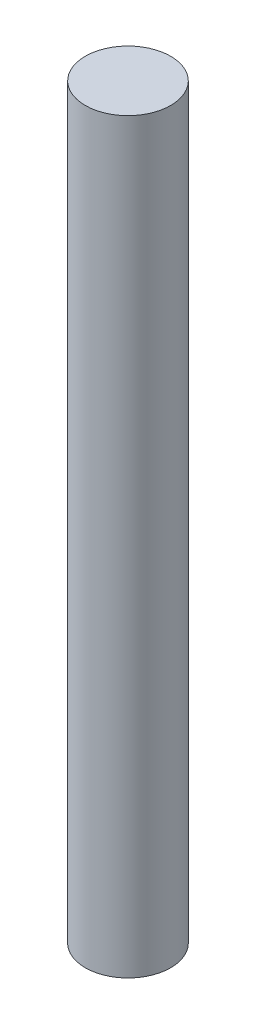
from build123d import *

# Parameters (mm, degrees)
SKETCH1_R           = 1
BOSS_EXTRUDE1_DEPTH = 17.5


with BuildPart() as part:
    # Sketch1 → Boss-Extrude1 (new body)
    with BuildSketch(Plane(origin=(0, 0, 0), x_dir=(1, 0, 0), z_dir=(0, 1, 0))):
        with Locations(Location((0, 0, 0), (0, 0, 270))):
            Circle(SKETCH1_R)
    extrude(amount=BOSS_EXTRUDE1_DEPTH)


solid = part.part
